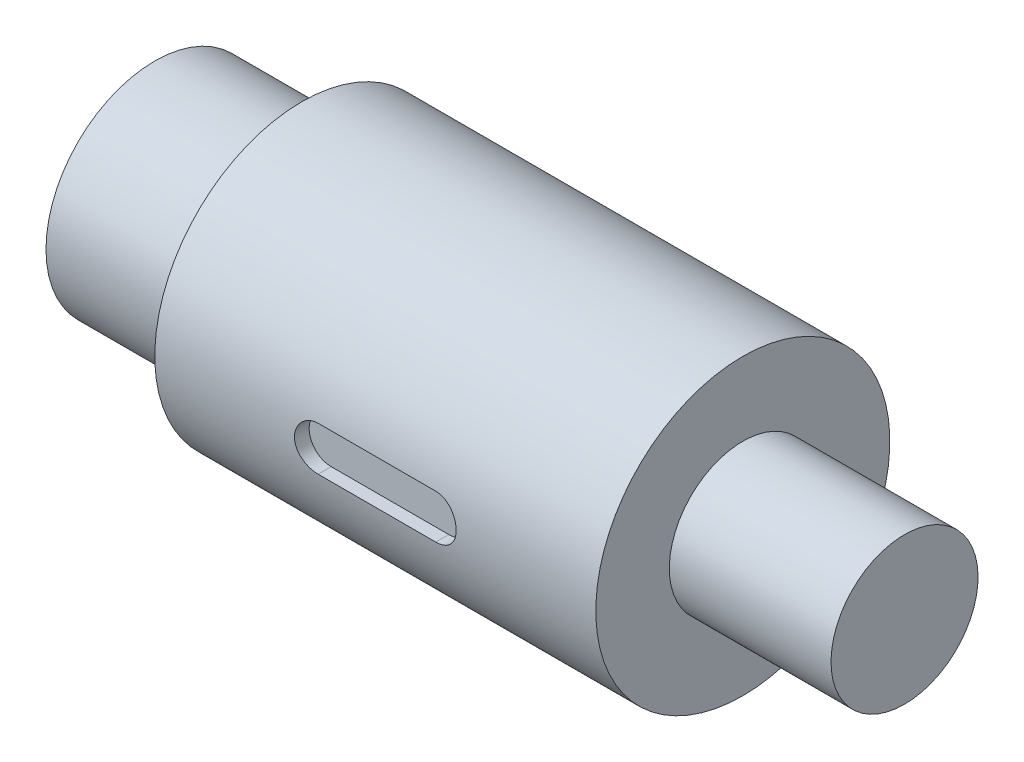
from build123d import *

# Parameters (mm, degrees)
CUT_EXTRUDE1_START = 9
CUT_EXTRUDE1_DEPTH = 10


with BuildPart() as part:
    # Sketch1 → Revolve1 (revolve)
    with BuildSketch(Plane.XY, mode=Mode.PRIVATE) as revolve1_sk:
        Polygon((0, 0), (0, 7.4), (10, 7.4), (10, 10), (40, 10), (40, 5), (51, 5), (51, 0), align=None)
    revolve(revolve1_sk.sketch.rotate(Axis((0, 0, 0), (1, 0, 0)), 180), axis=Axis((0, 0, 0), (1, 0, 0)))

    # Sketch2 → Cut-Extrude1 (cut)
    with BuildSketch(Plane.XY.offset(CUT_EXTRUDE1_START)):
        with BuildLine():
            Line((21, 1.5), (29, 1.5))
            ThreePointArc((29, 1.5), (30.5, 0), (29, -1.5))
            Line((29, -1.5), (21, -1.5))
            ThreePointArc((21, -1.5), (19.5, 0), (21, 1.5))
        make_face()
    extrude(amount=CUT_EXTRUDE1_DEPTH, mode=Mode.SUBTRACT)


solid = part.part
